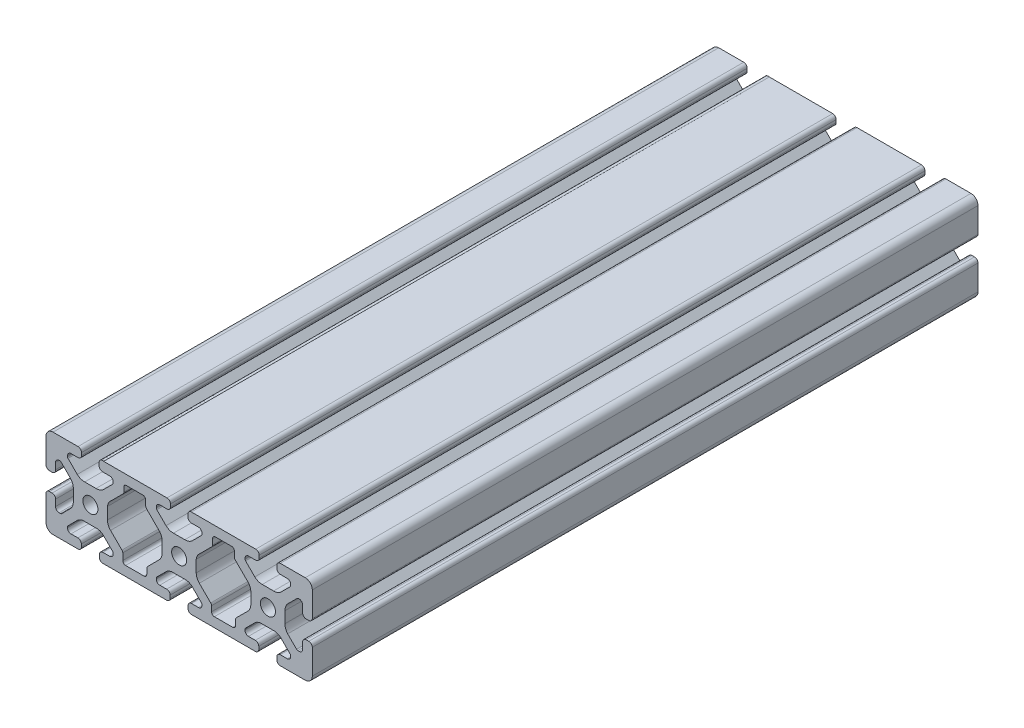
from build123d import *

# Parameters (mm, degrees)
SKETCH1_R      = 3.4
EXTRUDE1_DEPTH = 300


with BuildPart() as part:
    # Sketch1 → Extrude1 (new body)
    with BuildSketch(Plane.XY):
        with BuildLine():
            Line((-34.039664946, 20), (-5.483529002, 20))
            ThreePointArc((-5.483529002, 20), (-4.373371355, 19.540157646), (-3.913529002, 18.43))
            Line((-3.913529002, 18.43), (-3.913529002, 17.25))
            ThreePointArc((-3.913529002, 17.25), (-4.373371355, 16.139842354), (-5.483529002, 15.68))
            Line((-5.483529002, 15.68), (-8.715, 15.68))
            ThreePointArc((-8.715, 15.68), (-9.825157646, 15.220157646), (-10.285, 14.11))
            Line((-10.285, 14.11), (-10.285, 13.654503602))
            ThreePointArc((-10.285, 13.654503602), (-10.227148445, 13.363664194), (-10.062401154, 13.117102448))
            Line((-10.062401154, 13.117102448), (-5.908127218, 8.962828513))
            ThreePointArc((-5.908127218, 8.962828513), (-4.352583366, 8.002049766), (-2.549370008, 7.7))
            Line((-2.549370008, 7.7), (2.549370008, 7.7))
            ThreePointArc((2.549370008, 7.7), (4.352583366, 8.002049766), (5.908127218, 8.962828513))
            Line((5.908127218, 8.962828513), (10.062401154, 13.117102448))
            ThreePointArc((10.062401154, 13.117102448), (10.227148445, 13.363664194), (10.285, 13.654503602))
            Line((10.285, 13.654503602), (10.285, 14.11))
            ThreePointArc((10.285, 14.11), (9.825157646, 15.220157646), (8.715, 15.68))
            Line((8.715, 15.68), (5.481633908, 15.68))
            ThreePointArc((5.481633908, 15.68), (4.371476261, 16.139842354), (3.911633908, 17.25))
            Line((3.911633908, 17.25), (3.911633908, 18.43))
            ThreePointArc((3.911633908, 18.43), (4.371476261, 19.540157646), (5.481633908, 20))
            Line((5.481633908, 20), (34.516470998, 20))
            ThreePointArc((34.516470998, 20), (35.626628645, 19.540157646), (36.086470998, 18.43))
            Line((36.086470998, 18.43), (36.086470998, 17.25))
            ThreePointArc((36.086470998, 17.25), (35.626628645, 16.139842354), (34.516470998, 15.68))
            Line((34.516470998, 15.68), (31.285, 15.68))
            ThreePointArc((31.285, 15.68), (30.174842354, 15.220157646), (29.715, 14.11))
            Line((29.715, 14.11), (29.715, 13.654503602))
            ThreePointArc((29.715, 13.654503602), (29.772851555, 13.363664194), (29.937598846, 13.117102448))
            Line((29.937598846, 13.117102448), (34.091872782, 8.962828513))
            ThreePointArc((34.091872782, 8.962828513), (35.647416634, 8.002049766), (37.450629992, 7.7))
            Line((37.450629992, 7.7), (42.549370008, 7.7))
            ThreePointArc((42.549370008, 7.7), (44.352583366, 8.002049766), (45.908127218, 8.962828513))
            Line((45.908127218, 8.962828513), (50.062401154, 13.117102448))
            ThreePointArc((50.062401154, 13.117102448), (50.227148445, 13.363664194), (50.285, 13.654503602))
            Line((50.285, 13.654503602), (50.285, 14.11))
            ThreePointArc((50.285, 14.11), (49.825157646, 15.220157646), (48.715, 15.68))
            Line((48.715, 15.68), (45.569550674, 15.68))
            ThreePointArc((45.569550674, 15.68), (44.459393028, 16.139842354), (43.999550674, 17.25))
            Line((43.999550674, 17.25), (43.999550674, 18.43))
            ThreePointArc((43.999550674, 18.43), (44.459393028, 19.540157646), (45.569550674, 20))
            Line((45.569550674, 20), (53, 20))
            Line((53, 20), (56.83, 20))
            ThreePointArc((56.83, 20), (59.067780363, 19.075288119), (60, 16.840624931))
            Line((60, 16.840624931), (60, 13.010624931))
            Line((60, 13.010624931), (60, 5.582508737))
            ThreePointArc((60, 5.582508737), (59.463837117, 4.50713236), (58.324306777, 4.125850842))
            Line((58.324306777, 4.125850842), (57.144306777, 4.125850842))
            ThreePointArc((57.144306777, 4.125850842), (56.032016936, 4.688224348), (55.68, 5.883856704))
            Line((55.68, 5.883856704), (55.68, 8.786544652))
            ThreePointArc((55.68, 8.786544652), (55.220157646, 9.896702299), (54.11, 10.356544652))
            Line((54.11, 10.356544652), (53.726048254, 10.356544652))
            ThreePointArc((53.726048254, 10.356544652), (53.435208846, 10.298693097), (53.188647101, 10.133945806))
            Line((53.188647101, 10.133945806), (49.01112516, 5.956423865))
            ThreePointArc((49.01112516, 5.956423865), (48.019360521, 4.393900047), (47.7, 2.570966522))
            Line((47.7, 2.570966522), (47.7, -2.502014759))
            ThreePointArc((47.7, -2.502014759), (47.979996058, -4.299996729), (48.915473265, -5.86077197))
            Line((48.915473265, -5.86077197), (52.929133281, -9.874431986))
            ThreePointArc((52.929133281, -9.874431986), (53.175695026, -10.039179277), (53.466534434, -10.097030832))
            Line((53.466534434, -10.097030832), (54.110956402, -10.097030832))
            ThreePointArc((54.110956402, -10.097030832), (55.240319888, -9.617644474), (55.68, -8.472238622))
            Line((55.68, -8.472238622), (55.68, -5.569550674))
            ThreePointArc((55.68, -5.569550674), (56.139842354, -4.459393028), (57.25, -3.999550674))
            Line((57.25, -3.999550674), (58.43, -3.999550674))
            ThreePointArc((58.43, -3.999550674), (59.540157646, -4.459393028), (60, -5.569550674))
            Line((60, -5.569550674), (60, -13))
            Line((60, -13), (60, -16.83))
            ThreePointArc((60, -16.83), (59.134817946, -19.011326974), (57.006613773, -20))
            Line((57.006613773, -20), (53.176613773, -20))
            Line((53.176613773, -20), (45.746164447, -20))
            ThreePointArc((45.746164447, -20), (44.529723595, -19.606606664), (44.009186442, -18.438904761))
            Line((44.009186442, -18.438904761), (44.009186442, -17.209259175))
            ThreePointArc((44.009186442, -17.209259175), (44.483188152, -16.125346027), (45.579186442, -15.68))
            Line((45.579186442, -15.68), (48.689593221, -15.68))
            ThreePointArc((48.689593221, -15.68), (49.818956707, -15.200613642), (50.258636819, -14.05520779))
            Line((50.258636819, -14.05520779), (50.258636819, -13.719694805))
            ThreePointArc((50.258636819, -13.719694805), (50.200785264, -13.428855396), (50.036037973, -13.182293651))
            Line((50.036037973, -13.182293651), (46.258706785, -9.404962463))
            ThreePointArc((46.258706785, -9.404962463), (44.92885631, -8.297964566), (43.290732893, -7.740740825))
            Line((43.290732893, -7.740740825), (36.60763999, -7.740740825))
            ThreePointArc((36.60763999, -7.740740825), (34.969516573, -8.297964566), (33.639666098, -9.404962463))
            Line((33.639666098, -9.404962463), (29.911235665, -13.133392896))
            ThreePointArc((29.911235665, -13.133392896), (29.746488374, -13.379954641), (29.688636819, -13.670794049))
            Line((29.688636819, -13.670794049), (29.688636819, -14.05520779))
            ThreePointArc((29.688636819, -14.05520779), (30.111189478, -15.183383802), (31.208779662, -15.68))
            Line((31.208779662, -15.68), (34.319186442, -15.68))
            ThreePointArc((34.319186442, -15.68), (35.415184731, -16.125346027), (35.889186442, -17.209259175))
            Line((35.889186442, -17.209259175), (35.889186442, -18.43))
            ThreePointArc((35.889186442, -18.43), (35.429344088, -19.540157646), (34.319186442, -20))
            Line((34.319186442, -20), (25.940192472, -20))
            Line((25.940192472, -20), (21.729238859, -20))
            Line((21.729238859, -20), (13.958180411, -20))
            Line((13.958180411, -20), (5.579186442, -20))
            ThreePointArc((5.579186442, -20), (4.469028795, -19.540157646), (4.009186442, -18.43))
            Line((4.009186442, -18.43), (4.009186442, -17.209259175))
            ThreePointArc((4.009186442, -17.209259175), (4.483188152, -16.125346027), (5.579186442, -15.68))
            Line((5.579186442, -15.68), (8.689593221, -15.68))
            ThreePointArc((8.689593221, -15.68), (9.799750867, -15.220157646), (10.259593221, -14.11))
            Line((10.259593221, -14.11), (10.259593221, -13.670794049))
            ThreePointArc((10.259593221, -13.670794049), (10.201741665, -13.379954641), (10.036994374, -13.133392896))
            Line((10.036994374, -13.133392896), (6.308563942, -9.404962463))
            ThreePointArc((6.308563942, -9.404962463), (4.978713467, -8.297964566), (3.34059005, -7.740740825))
            Line((3.34059005, -7.740740825), (-3.342502853, -7.740740825))
            ThreePointArc((-3.342502853, -7.740740825), (-4.98062627, -8.297964566), (-6.310476745, -9.404962463))
            Line((-6.310476745, -9.404962463), (-10.087807933, -13.182293651))
            ThreePointArc((-10.087807933, -13.182293651), (-10.252555224, -13.428855396), (-10.310406779, -13.719694805))
            Line((-10.310406779, -13.719694805), (-10.310406779, -14.11))
            ThreePointArc((-10.310406779, -14.11), (-9.850564426, -15.220157646), (-8.740406779, -15.68))
            Line((-8.740406779, -15.68), (-5.63, -15.68))
            ThreePointArc((-5.63, -15.68), (-4.534001711, -16.125346027), (-4.06, -17.209259175))
            Line((-4.06, -17.209259175), (-4.06, -18.43))
            ThreePointArc((-4.06, -18.43), (-4.519842354, -19.540157646), (-5.63, -20))
            Line((-5.63, -20), (-14.00899397, -20))
            Line((-14.00899397, -20), (-21.780052417, -20))
            Line((-21.780052417, -20), (-25.99100603, -20))
            Line((-25.99100603, -20), (-34.37, -20))
            ThreePointArc((-34.37, -20), (-35.480157646, -19.540157646), (-35.94, -18.43))
            Line((-35.94, -18.43), (-35.94, -17.25))
            ThreePointArc((-35.94, -17.25), (-35.480157646, -16.139842354), (-34.37, -15.68))
            Line((-34.37, -15.68), (-31.259593221, -15.68))
            ThreePointArc((-31.259593221, -15.68), (-30.18116243, -15.203502372), (-29.73846722, -14.110760907))
            Line((-29.73846722, -14.110760907), (-29.73846722, -13.672733609))
            ThreePointArc((-29.73846722, -13.672733609), (-29.796318775, -13.3818942), (-29.961066066, -13.135332455))
            Line((-29.961066066, -13.135332455), (-33.691436058, -9.404962463))
            ThreePointArc((-33.691436058, -9.404962463), (-35.021286533, -8.297964566), (-36.65940995, -7.740740825))
            Line((-36.65940995, -7.740740825), (-43.342502853, -7.740740825))
            ThreePointArc((-43.342502853, -7.740740825), (-44.98062627, -8.297964566), (-46.310476745, -9.404962463))
            Line((-46.310476745, -9.404962463), (-50.087807933, -13.182293651))
            ThreePointArc((-50.087807933, -13.182293651), (-50.252555224, -13.428855396), (-50.310406779, -13.719694805))
            Line((-50.310406779, -13.719694805), (-50.310406779, -14.11))
            ThreePointArc((-50.310406779, -14.11), (-49.850564426, -15.220157646), (-48.740406779, -15.68))
            Line((-48.740406779, -15.68), (-45.63, -15.68))
            ThreePointArc((-45.63, -15.68), (-44.519842354, -16.139842354), (-44.06, -17.25))
            Line((-44.06, -17.25), (-44.06, -18.438904761))
            ThreePointArc((-44.06, -18.438904761), (-44.580537154, -19.606606664), (-45.796978006, -20))
            Line((-45.796978006, -20), (-53.227427332, -20))
            Line((-53.227427332, -20), (-57.057427332, -20))
            ThreePointArc((-57.057427332, -20), (-59.153330856, -18.99480488), (-60, -16.83))
            Line((-60, -16.83), (-60, -13))
            Line((-60, -13), (-60, -5.569550674))
            ThreePointArc((-60, -5.569550674), (-59.540157646, -4.459393028), (-58.43, -3.999550674))
            Line((-58.43, -3.999550674), (-57.25, -3.999550674))
            ThreePointArc((-57.25, -3.999550674), (-56.139842354, -4.459393028), (-55.68, -5.569550674))
            Line((-55.68, -5.569550674), (-55.68, -8.472238622))
            ThreePointArc((-55.68, -8.472238622), (-55.240319888, -9.617644474), (-54.110956402, -10.097030832))
            Line((-54.110956402, -10.097030832), (-53.466534434, -10.097030832))
            ThreePointArc((-53.466534434, -10.097030832), (-53.175695026, -10.039179277), (-52.929133281, -9.874431986))
            Line((-52.929133281, -9.874431986), (-48.915473265, -5.86077197))
            ThreePointArc((-48.915473265, -5.86077197), (-47.979996058, -4.299996729), (-47.7, -2.502014759))
            Line((-47.7, -2.502014759), (-47.7, 2.570966522))
            ThreePointArc((-47.7, 2.570966522), (-48.019360521, 4.393900047), (-49.01112516, 5.956423865))
            Line((-49.01112516, 5.956423865), (-53.188647101, 10.133945806))
            ThreePointArc((-53.188647101, 10.133945806), (-53.435208846, 10.298693097), (-53.726048254, 10.356544652))
            Line((-53.726048254, 10.356544652), (-54.11, 10.356544652))
            ThreePointArc((-54.11, 10.356544652), (-55.220157646, 9.896702299), (-55.68, 8.786544652))
            Line((-55.68, 8.786544652), (-55.68, 5.883856704))
            ThreePointArc((-55.68, 5.883856704), (-56.032016936, 4.688224348), (-57.144306777, 4.125850842))
            Line((-57.144306777, 4.125850842), (-58.324306777, 4.125850842))
            ThreePointArc((-58.324306777, 4.125850842), (-59.463837117, 4.50713236), (-60, 5.582508737))
            Line((-60, 5.582508737), (-60, 13.010624931))
            Line((-60, 13.010624931), (-60, 16.840624931))
            ThreePointArc((-60, 16.840624931), (-59.067780363, 19.075288119), (-56.83, 20))
            Line((-56.83, 20), (-53, 20))
            Line((-53, 20), (-45.569550674, 20))
            ThreePointArc((-45.569550674, 20), (-44.459393028, 19.540157646), (-43.999550674, 18.43))
            Line((-43.999550674, 18.43), (-43.999550674, 17.25))
            ThreePointArc((-43.999550674, 17.25), (-44.459393028, 16.139842354), (-45.569550674, 15.68))
            Line((-45.569550674, 15.68), (-48.715, 15.68))
            ThreePointArc((-48.715, 15.68), (-49.825157646, 15.220157646), (-50.285, 14.11))
            Line((-50.285, 14.11), (-50.285, 13.654503602))
            ThreePointArc((-50.285, 13.654503602), (-50.227148445, 13.363664194), (-50.062401154, 13.117102448))
            Line((-50.062401154, 13.117102448), (-45.908127218, 8.962828513))
            ThreePointArc((-45.908127218, 8.962828513), (-44.352583366, 8.002049766), (-42.549370008, 7.7))
            Line((-42.549370008, 7.7), (-37.450629992, 7.7))
            ThreePointArc((-37.450629992, 7.7), (-35.647416634, 8.002049766), (-34.091872782, 8.962828513))
            Line((-34.091872782, 8.962828513), (-29.937598846, 13.117102448))
            ThreePointArc((-29.937598846, 13.117102448), (-29.772851555, 13.363664194), (-29.715, 13.654503602))
            Line((-29.715, 13.654503602), (-29.715, 14.11))
            ThreePointArc((-29.715, 14.11), (-30.174842354, 15.220157646), (-31.285, 15.68))
            Line((-31.285, 15.68), (-34.516469227, 15.68))
            ThreePointArc((-34.516469227, 15.68), (-35.625793929, 16.139008264), (-36.086469227, 17.247641725))
            Line((-36.086469227, 17.247641725), (-36.086469227, 18.427641725))
            ThreePointArc((-36.086469227, 18.427641725), (-35.474804984, 19.749797238), (-34.039664946, 20))
        make_face()
        with Locations((-40, 0)):
            Circle(SKETCH1_R, mode=Mode.SUBTRACT)
        with Locations(Location((0, 0, 0), (0, 0, 180))):
            Circle(SKETCH1_R, mode=Mode.SUBTRACT)
        with Locations(Location((40, 0, 0), (0, 0, 180))):
            Circle(SKETCH1_R, mode=Mode.SUBTRACT)
        with BuildLine():
            Line((-16.336610335, 15.68), (-23.663389665, 15.68))
            ThreePointArc((-23.663389665, 15.68), (-24.423528742, 15.498374024), (-24.933389665, 14.906055487))
            Line((-24.933389665, 14.906055487), (-24.933389665, 12.537960264))
            ThreePointArc((-24.933389665, 12.537960264), (-25.030062659, 12.051952305), (-25.305364053, 11.639934652))
            Line((-25.305364053, 11.639934652), (-30.598777023, 6.346521682))
            ThreePointArc((-30.598777023, 6.346521682), (-31.746399861, 4.966462595), (-32.3, 3.259087959))
            Line((-32.3, 3.259087959), (-32.3, -2.025205833))
            ThreePointArc((-32.3, -2.025205833), (-31.938427779, -3.842952137), (-30.908757211, -5.383963044))
            Line((-30.908757211, -5.383963044), (-25.78141954, -10.511300715))
            ThreePointArc((-25.78141954, -10.511300715), (-25.506118146, -10.923318368), (-25.409445152, -11.409326327))
            Line((-25.409445152, -11.409326327), (-25.409445152, -14.41))
            ThreePointArc((-25.409445152, -14.41), (-25.037470764, -15.308025612), (-24.139445152, -15.68))
            Line((-24.139445152, -15.68), (-15.860554848, -15.68))
            ThreePointArc((-15.860554848, -15.68), (-14.962529236, -15.308025612), (-14.590554848, -14.41))
            Line((-14.590554848, -14.41), (-14.590554848, -12.041904777))
            ThreePointArc((-14.590554848, -12.041904777), (-14.493881854, -11.555896818), (-14.21858046, -11.143879165))
            Line((-14.21858046, -11.143879165), (-9.091242789, -6.016541495))
            ThreePointArc((-9.091242789, -6.016541495), (-8.061572221, -4.475530588), (-7.7, -2.657784284))
            Line((-7.7, -2.657784284), (-7.7, 2.626509509))
            ThreePointArc((-7.7, 2.626509509), (-8.229034521, 4.408178136), (-9.401222977, 5.850466196))
            Line((-9.401222977, 5.850466196), (-14.694635947, 11.143879165))
            ThreePointArc((-14.694635947, 11.143879165), (-14.969937341, 11.555896818), (-15.066610335, 12.041904777))
            Line((-15.066610335, 12.041904777), (-15.066610335, 14.41))
            ThreePointArc((-15.066610335, 14.41), (-15.438584723, 15.308025612), (-16.336610335, 15.68))
        make_face(mode=Mode.SUBTRACT)
        with BuildLine():
            Line((15.066610335, 14.273477036), (15.066610335, 11.905381813))
            ThreePointArc((15.066610335, 11.905381813), (14.969937341, 11.419373854), (14.694635947, 11.007356201))
            Line((14.694635947, 11.007356201), (9.401222977, 5.713943232))
            ThreePointArc((9.401222977, 5.713943232), (8.253600139, 4.333884145), (7.7, 2.626509509))
            Line((7.7, 2.626509509), (7.7, -2.657784284))
            ThreePointArc((7.7, -2.657784284), (8.061572221, -4.475530588), (9.091242789, -6.016541495))
            Line((9.091242789, -6.016541495), (14.21858046, -11.143879165))
            ThreePointArc((14.21858046, -11.143879165), (14.493881854, -11.555896818), (14.590554848, -12.041904777))
            Line((14.590554848, -12.041904777), (14.590554848, -14.41))
            ThreePointArc((14.590554848, -14.41), (14.962529236, -15.308025612), (15.860554848, -15.68))
            Line((15.860554848, -15.68), (24.139445152, -15.68))
            ThreePointArc((24.139445152, -15.68), (25.037470764, -15.308025612), (25.409445152, -14.41))
            Line((25.409445152, -14.41), (25.409445152, -12.041904777))
            ThreePointArc((25.409445152, -12.041904777), (25.506118146, -11.555896818), (25.78141954, -11.143879165))
            Line((25.78141954, -11.143879165), (30.908757211, -6.016541495))
            ThreePointArc((30.908757211, -6.016541495), (31.938427779, -4.475530588), (32.3, -2.657784284))
            Line((32.3, -2.657784284), (32.3, 2.626509509))
            ThreePointArc((32.3, 2.626509509), (31.770965479, 4.408178136), (30.598777023, 5.850466196))
            Line((30.598777023, 5.850466196), (25.305364053, 11.143879165))
            ThreePointArc((25.305364053, 11.143879165), (25.030062659, 11.555896818), (24.933389665, 12.041904777))
            Line((24.933389665, 12.041904777), (24.933389665, 14.41))
            ThreePointArc((24.933389665, 14.41), (24.561415277, 15.308025612), (23.663389665, 15.68))
            Line((23.663389665, 15.68), (16.336610335, 15.68))
            ThreePointArc((16.336610335, 15.68), (15.386642405, 15.261134351), (15.066610335, 14.273477036))
        make_face(mode=Mode.SUBTRACT)
    extrude(amount=-EXTRUDE1_DEPTH)


solid = part.part
